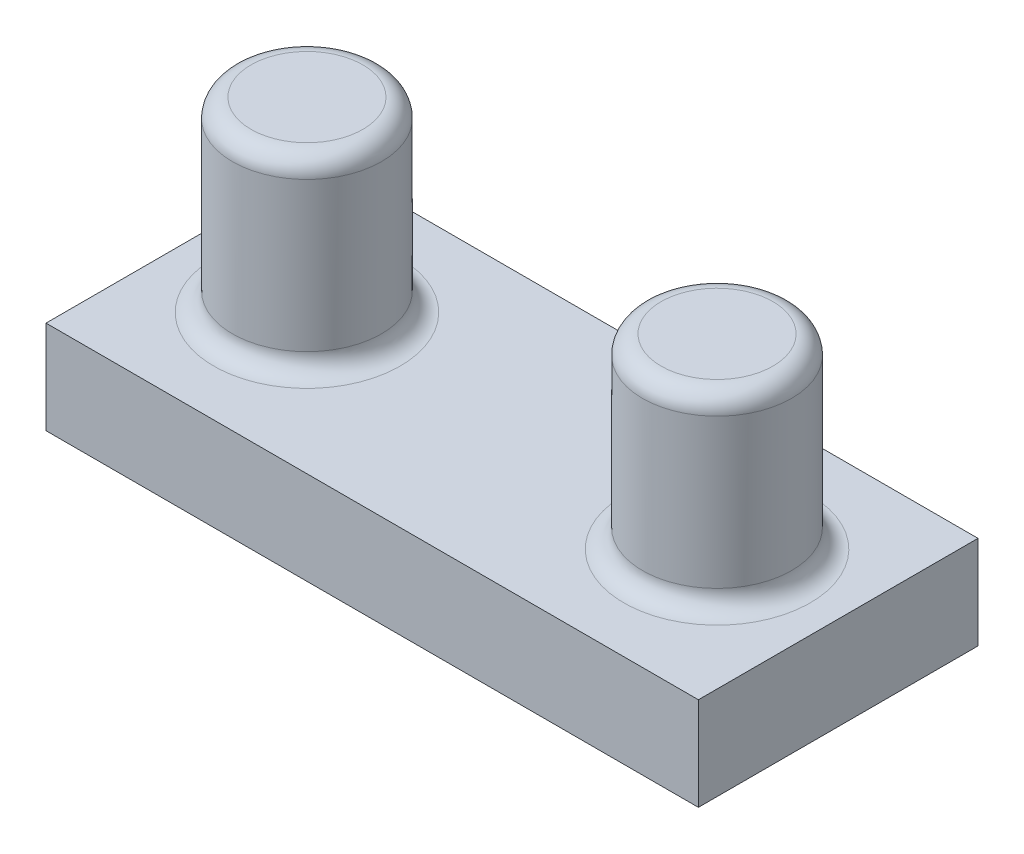
from build123d import *

# Parameters (mm, degrees)
SKETCH1_R             = 4
BOSS_EXTRUDE1_DEPTH   = 10
BOSS_EXTRUDE1_2_DEPTH = 10
SKETCH2_W             = 35
SKETCH2_H             = 15
BOSS_EXTRUDE2_DEPTH   = 5
FILLET1_R             = 1
CUT_EXTRUDE1_DEPTH    = 1


with BuildPart() as part:
    # Sketch1 → Boss-Extrude1 (new body)
    with BuildSketch(Plane(origin=(0, 0, 0), x_dir=(1, 0, 0), z_dir=(0, 1, 0))):
        with Locations(Location((11.086709746, 7.169703638, 0), (0, 0, 270))):
            Circle(SKETCH1_R)
    extrude(amount=BOSS_EXTRUDE1_DEPTH)



with BuildPart() as body_2:
    # Sketch1 → Boss-Extrude1 2 (new body)
    with BuildSketch(Plane(origin=(0, 0, 0), x_dir=(1, 0, 0), z_dir=(0, 1, 0))):
        with Locations(Location((-10.913290254, 7.169703638, 0), (0, 0, 270))):
            Circle(SKETCH1_R)
    extrude(amount=BOSS_EXTRUDE1_2_DEPTH)


with BuildPart() as part_1:
    add(part.part)

    add(body_2.part)  # Boss-Extrude2 merges body 2
    # Sketch2 → Boss-Extrude2 (add)
    with BuildSketch(Plane(origin=(0, 0, 0), x_dir=(-1, 0, 0), z_dir=(0, -1, 0))):
        with Locations((-0.086709746, 7.169703638)):
            Rectangle(SKETCH2_W, SKETCH2_H)
    extrude(amount=BOSS_EXTRUDE2_DEPTH)

    # Fillet1
    fillet1_edges = [part_1.edges().sort_by_distance(p)[0] for p in [
        (-10.913290254, 0, -11.169703638),
        (-10.913290254, 10, -11.169703638),
        (11.086709746, 10, -11.169703638),
        (11.086709746, 0, -11.169703638),
    ]]
    fillet(fillet1_edges, radius=FILLET1_R)

    # Sketch3 → Cut-Extrude1 (cut)
    with BuildSketch(Plane(origin=(0, 0, -14.669703638), x_dir=(-1, 0, 0), z_dir=(0, 0, -1))):
        with BuildLine():
            Line((4.304418078, -1.853490886), (4.618520642, -1.853490886))
            Line((4.618520642, -1.853490886), (4.618520642, -2.298002104))
            add(Edge.make_bspline(
                [(4.618520642, -2.298002104), (4.646804592, -2.259114502), (4.700999351, -2.184602129), (4.789865004, -2.086411845), (4.878641116, -2.00308369), (4.942574498, -1.959340819), (4.97328827, -1.938326623)],
                knots=[0, 0, 0, 0, 1.134379233, 2.173579362, 3.122582517, 4, 4, 4, 4], degree=3))
            add(Edge.make_bspline(
                [(4.97328827, -1.938326623), (5.015152932, -1.918321258), (5.098150832, -1.878660045), (5.229570057, -1.838426486), (5.364044726, -1.813701385), (5.45485294, -1.810320011), (5.50053186, -1.808619091)],
                knots=[0, 0, 0, 0, 1.014936303, 2.012140481, 3.000054389, 4, 4, 4, 4], degree=3))
            add(Edge.make_bspline(
                [(5.50053186, -1.808619091), (5.531424856, -1.809664382), (5.592560435, -1.811732956), (5.683144526, -1.825192992), (5.771003137, -1.848459165), (5.855617167, -1.880866489), (5.935337846, -1.920113175), (6.008427044, -1.966162883), (6.074051252, -2.017859959), (6.132177303, -2.077538892), (6.184446329, -2.14687549), (6.232525175, -2.227739739), (6.276950388, -2.3219474), (6.301571696, -2.390313941), (6.314534264, -2.426307393)],
                knots=[0, 0, 0, 0, 1.009824226, 1.998387844, 2.986035974, 3.974953746, 4.955485308, 5.885931332, 6.793869504, 7.679848016, 8.601185859, 9.625726857, 10.749998409, 12, 12, 12, 12], degree=3))
            add(Edge.make_bspline(
                [(6.314534264, -2.426307393), (6.328245515, -2.401582973), (6.355227332, -2.352928788), (6.400532969, -2.284070526), (6.448000766, -2.219663734), (6.498035259, -2.15965731), (6.550459846, -2.10434758), (6.605521246, -2.053551678), (6.662906027, -2.007051464), (6.742698267, -1.952728305), (6.846510875, -1.895027123), (6.977398989, -1.844998679), (7.113549161, -1.814082551), (7.205966859, -1.810452278), (7.252635225, -1.808619091)],
                knots=[0, 0, 0, 0, 0.86119277, 1.694706429, 2.50939023, 3.298075842, 4.073795165, 4.829715201, 5.57930267, 6.321991688, 7.768977793, 9.186738141, 10.579381044, 12, 12, 12, 12], degree=3))
            add(Edge.make_bspline(
                [(7.252635225, -1.808619091), (7.295516688, -1.810236312), (7.379439874, -1.81340137), (7.50161714, -1.838254844), (7.615558945, -1.880932491), (7.721036021, -1.939166127), (7.816195835, -2.012345311), (7.898912144, -2.099414148), (7.968682507, -2.199756771), (8.014261147, -2.29414876), (8.045176411, -2.377484093), (8.064237646, -2.448490384), (8.081077341, -2.526641937), (8.095058586, -2.612032199), (8.105277138, -2.704962807), (8.112847854, -2.805281683), (8.117971927, -2.913066794), (8.118333999, -2.987432295), (8.118520642, -3.025766527)],
                knots=[0, 0, 0, 0, 1.209669288, 2.367440248, 3.500751976, 4.631527125, 5.755587489, 6.87532382, 8.007944318, 9.190864318, 9.82315674, 10.514484317, 11.263564316, 12.079023757, 12.955305781, 13.901327259, 14.918167583, 16, 16, 16, 16], degree=3))
            Line((8.118520642, -3.025766527), (8.118520642, -4.411183194))
            Line((8.118520642, -4.411183194), (7.804418078, -4.411183194))
            Line((7.804418078, -4.411183194), (7.804418078, -3.024364284))
            add(Edge.make_bspline(
                [(7.804418078, -3.024364284), (7.804340195, -2.99164371), (7.804190516, -2.928759743), (7.801496884, -2.838507292), (7.79642157, -2.756238934), (7.790486931, -2.682066846), (7.782243122, -2.615818058), (7.77159719, -2.557625639), (7.76031951, -2.507031828), (7.741583519, -2.45094578), (7.711635627, -2.38907557), (7.666018147, -2.322351994), (7.608548041, -2.264271194), (7.542187885, -2.213852877), (7.46663944, -2.172859236), (7.383374717, -2.143583226), (7.292910665, -2.125460348), (7.230287877, -2.123654332), (7.197947725, -2.122721655)],
                knots=[0, 0, 0, 0, 1.253487763, 2.409012846, 3.458416907, 4.410876679, 5.259312806, 6.014470957, 6.676830364, 7.243083969, 8.276244668, 9.299465089, 10.325150304, 11.392391894, 12.482080715, 13.603491619, 14.762376348, 16, 16, 16, 16], degree=3))
            add(Edge.make_bspline(
                [(7.197947725, -2.122721655), (7.158277771, -2.124137813), (7.07987486, -2.126936678), (6.965429373, -2.155510551), (6.855458357, -2.198590802), (6.753243224, -2.261023259), (6.659215433, -2.335831623), (6.578315856, -2.424781219), (6.51148367, -2.525411146), (6.466229694, -2.618557848), (6.437640393, -2.702227292), (6.418763477, -2.775324664), (6.404080085, -2.858406232), (6.390309556, -2.950913722), (6.381321828, -3.053483903), (6.373153456, -3.165642304), (6.369332593, -3.287726263), (6.368798134, -3.372352952), (6.368520642, -3.416291367)],
                knots=[0, 0, 0, 0, 1.090531906, 2.155305635, 3.229839962, 4.33261226, 5.44038871, 6.529323825, 7.629011124, 8.757537029, 9.370236727, 10.061839251, 10.834451254, 11.692844982, 12.636905849, 13.66920014, 14.789842145, 16, 16, 16, 16], degree=3))
            Line((6.368520642, -3.416291367), (6.368520642, -4.411183194))
            Line((6.368520642, -4.411183194), (6.054418078, -4.411183194))
            Line((6.054418078, -4.411183194), (6.054418078, -3.110602264))
            add(Edge.make_bspline(
                [(6.054418078, -3.110602264), (6.054338647, -3.073908946), (6.05418583, -3.003314688), (6.051509512, -2.902081013), (6.046422891, -2.809999933), (6.040542342, -2.727178469), (6.032082164, -2.65376714), (6.022472402, -2.589372382), (6.011123791, -2.534155631), (5.992333906, -2.473592247), (5.963619438, -2.406871324), (5.917431176, -2.335730302), (5.859823596, -2.273462205), (5.79225272, -2.220303456), (5.716247038, -2.176361975), (5.632263637, -2.144702223), (5.541058724, -2.126277934), (5.478181018, -2.123929437), (5.44584436, -2.122721655)],
                knots=[0, 0, 0, 0, 1.320475261, 2.540461679, 3.643808994, 4.639130445, 5.527981419, 6.302341397, 6.981980563, 7.553956391, 8.582137848, 9.585246428, 10.591171744, 11.620968678, 12.668337649, 13.738356861, 14.836885341, 16, 16, 16, 16], degree=3))
            add(Edge.make_bspline(
                [(5.44584436, -2.122721655), (5.407828148, -2.124252115), (5.332063189, -2.127302268), (5.220761219, -2.154756542), (5.113275536, -2.197760617), (5.011320837, -2.257420436), (4.917646689, -2.331319514), (4.835638421, -2.41823441), (4.766695896, -2.517083444), (4.720964081, -2.60924796), (4.691465607, -2.690821235), (4.671870272, -2.760172183), (4.655030646, -2.837172431), (4.642516625, -2.922059542), (4.630436209, -3.014280636), (4.6246059, -3.114295126), (4.618934338, -3.222017214), (4.618661923, -3.296389759), (4.618520642, -3.334961239)],
                knots=[0, 0, 0, 0, 1.098833095, 2.189935336, 3.297829714, 4.440610912, 5.596351641, 6.740013378, 7.886572111, 9.072425424, 9.705826452, 10.395263256, 11.156850408, 11.985370555, 12.878090359, 13.847760091, 14.883794034, 16, 16, 16, 16], degree=3))
            Line((4.618520642, -3.334961239), (4.618520642, -4.411183194))
            Line((4.618520642, -4.411183194), (4.304418078, -4.411183194))
            Line((4.304418078, -4.411183194), (4.304418078, -1.853490886))
        make_face()
        with BuildLine():
            Line((-0.227633204, -1.853490886), (0.08646936, -1.853490886))
            Line((0.08646936, -1.853490886), (0.08646936, -2.298002104))
            add(Edge.make_bspline(
                [(0.08646936, -2.298002104), (0.11475331, -2.259114502), (0.168948069, -2.184602129), (0.257813722, -2.086411845), (0.346589834, -2.00308369), (0.410523216, -1.959340819), (0.441236988, -1.938326623)],
                knots=[0, 0, 0, 0, 1.134379233, 2.173579362, 3.122582517, 4, 4, 4, 4], degree=3))
            add(Edge.make_bspline(
                [(0.441236988, -1.938326623), (0.48310165, -1.918321258), (0.56609955, -1.878660045), (0.697518775, -1.838426486), (0.831993444, -1.813701385), (0.922801658, -1.810320011), (0.968480578, -1.808619091)],
                knots=[0, 0, 0, 0, 1.014936303, 2.012140481, 3.000054389, 4, 4, 4, 4], degree=3))
            add(Edge.make_bspline(
                [(0.968480578, -1.808619091), (0.999373574, -1.809664382), (1.060509153, -1.811732956), (1.151093243, -1.825192992), (1.238951855, -1.848459165), (1.323565885, -1.880866489), (1.403286564, -1.920113175), (1.476375762, -1.966162883), (1.54199997, -2.017859959), (1.600126021, -2.077538892), (1.652395047, -2.14687549), (1.700473893, -2.227739739), (1.744899106, -2.3219474), (1.769520414, -2.390313941), (1.782482982, -2.426307393)],
                knots=[0, 0, 0, 0, 1.009824226, 1.998387844, 2.986035974, 3.974953746, 4.955485308, 5.885931332, 6.793869504, 7.679848016, 8.601185859, 9.625726857, 10.749998409, 12, 12, 12, 12], degree=3))
            add(Edge.make_bspline(
                [(1.782482982, -2.426307393), (1.796194233, -2.401582973), (1.82317605, -2.352928788), (1.868481687, -2.284070526), (1.915949484, -2.219663734), (1.965983977, -2.15965731), (2.018408564, -2.10434758), (2.073469964, -2.053551678), (2.130854745, -2.007051464), (2.210646985, -1.952728305), (2.314459593, -1.895027123), (2.445347707, -1.844998679), (2.581497879, -1.814082551), (2.673915577, -1.810452278), (2.720583943, -1.808619091)],
                knots=[0, 0, 0, 0, 0.86119277, 1.694706429, 2.50939023, 3.298075842, 4.073795165, 4.829715201, 5.57930267, 6.321991688, 7.768977793, 9.186738141, 10.579381044, 12, 12, 12, 12], degree=3))
            add(Edge.make_bspline(
                [(2.720583943, -1.808619091), (2.763465406, -1.810236312), (2.847388592, -1.81340137), (2.969565858, -1.838254844), (3.083507663, -1.880932491), (3.188984739, -1.939166127), (3.284144553, -2.012345311), (3.366860862, -2.099414148), (3.436631225, -2.199756771), (3.482209865, -2.29414876), (3.513125129, -2.377484093), (3.532186364, -2.448490384), (3.549026059, -2.526641937), (3.563007304, -2.612032199), (3.573225856, -2.704962807), (3.580796572, -2.805281683), (3.585920645, -2.913066794), (3.586282717, -2.987432295), (3.58646936, -3.025766527)],
                knots=[0, 0, 0, 0, 1.209669288, 2.367440248, 3.500751976, 4.631527125, 5.755587489, 6.87532382, 8.007944318, 9.190864318, 9.82315674, 10.514484317, 11.263564316, 12.079023757, 12.955305781, 13.901327259, 14.918167583, 16, 16, 16, 16], degree=3))
            Line((3.58646936, -3.025766527), (3.58646936, -4.411183194))
            Line((3.58646936, -4.411183194), (3.272366796, -4.411183194))
            Line((3.272366796, -4.411183194), (3.272366796, -3.024364284))
            add(Edge.make_bspline(
                [(3.272366796, -3.024364284), (3.272288913, -2.99164371), (3.272139234, -2.928759743), (3.269445602, -2.838507292), (3.264370288, -2.756238934), (3.258435649, -2.682066846), (3.25019184, -2.615818058), (3.239545908, -2.557625639), (3.228268228, -2.507031828), (3.209532237, -2.45094578), (3.179584345, -2.38907557), (3.133966865, -2.322351994), (3.076496759, -2.264271194), (3.010136603, -2.213852877), (2.934588158, -2.172859236), (2.851323435, -2.143583226), (2.760859383, -2.125460348), (2.698236595, -2.123654332), (2.665896443, -2.122721655)],
                knots=[0, 0, 0, 0, 1.253487763, 2.409012846, 3.458416907, 4.410876679, 5.259312806, 6.014470957, 6.676830364, 7.243083969, 8.276244668, 9.299465089, 10.325150304, 11.392391894, 12.482080715, 13.603491619, 14.762376348, 16, 16, 16, 16], degree=3))
            add(Edge.make_bspline(
                [(2.665896443, -2.122721655), (2.626226489, -2.124137813), (2.547823578, -2.126936678), (2.433378091, -2.155510551), (2.323407075, -2.198590802), (2.221191942, -2.261023259), (2.127164151, -2.335831623), (2.046264573, -2.424781219), (1.979432388, -2.525411146), (1.934178412, -2.618557848), (1.905589111, -2.702227292), (1.886712195, -2.775324664), (1.872028803, -2.858406232), (1.858258274, -2.950913722), (1.849270546, -3.053483903), (1.841102174, -3.165642304), (1.837281311, -3.287726263), (1.836746852, -3.372352952), (1.83646936, -3.416291367)],
                knots=[0, 0, 0, 0, 1.090531906, 2.155305635, 3.229839962, 4.33261226, 5.44038871, 6.529323825, 7.629011124, 8.757537029, 9.370236727, 10.061839251, 10.834451254, 11.692844982, 12.636905849, 13.66920014, 14.789842145, 16, 16, 16, 16], degree=3))
            Line((1.83646936, -3.416291367), (1.83646936, -4.411183194))
            Line((1.83646936, -4.411183194), (1.522366796, -4.411183194))
            Line((1.522366796, -4.411183194), (1.522366796, -3.110602264))
            add(Edge.make_bspline(
                [(1.522366796, -3.110602264), (1.522287365, -3.073908946), (1.522134548, -3.003314688), (1.51945823, -2.902081013), (1.514371609, -2.809999933), (1.50849106, -2.727178469), (1.500030882, -2.65376714), (1.49042112, -2.589372382), (1.479072509, -2.534155631), (1.460282624, -2.473592247), (1.431568156, -2.406871324), (1.385379894, -2.335730302), (1.327772314, -2.273462205), (1.260201438, -2.220303456), (1.184195756, -2.176361975), (1.100212355, -2.144702223), (1.009007442, -2.126277934), (0.946129736, -2.123929437), (0.913793078, -2.122721655)],
                knots=[0, 0, 0, 0, 1.320475261, 2.540461679, 3.643808994, 4.639130445, 5.527981419, 6.302341397, 6.981980563, 7.553956391, 8.582137848, 9.585246428, 10.591171744, 11.620968678, 12.668337649, 13.738356861, 14.836885341, 16, 16, 16, 16], degree=3))
            add(Edge.make_bspline(
                [(0.913793078, -2.122721655), (0.875776866, -2.124252115), (0.800011907, -2.127302268), (0.688709937, -2.154756542), (0.581224254, -2.197760617), (0.479269555, -2.257420436), (0.385595407, -2.331319514), (0.303587139, -2.41823441), (0.234644614, -2.517083444), (0.188912799, -2.60924796), (0.159414325, -2.690821235), (0.13981899, -2.760172183), (0.122979364, -2.837172431), (0.110465342, -2.922059542), (0.098384927, -3.014280636), (0.092554618, -3.114295126), (0.086883056, -3.222017214), (0.086610641, -3.296389759), (0.08646936, -3.334961239)],
                knots=[0, 0, 0, 0, 1.098833095, 2.189935336, 3.297829714, 4.440610912, 5.596351641, 6.740013378, 7.886572111, 9.072425424, 9.705826452, 10.395263256, 11.156850408, 11.985370555, 12.878090359, 13.847760091, 14.883794034, 16, 16, 16, 16], degree=3))
            Line((0.08646936, -3.334961239), (0.08646936, -4.411183194))
            Line((0.08646936, -4.411183194), (-0.227633204, -4.411183194))
            Line((-0.227633204, -4.411183194), (-0.227633204, -1.853490886))
        make_face()
        with BuildLine():
            Line((-4.041735768, -1.988106271), (-4.355838332, -1.988106271))
            add(Edge.make_bspline(
                [(-4.355838332, -1.988106271), (-4.353791179, -1.946435383), (-4.349770625, -1.864594868), (-4.330942336, -1.745270962), (-4.304001459, -1.631216163), (-4.265910005, -1.523346249), (-4.218603727, -1.420707442), (-4.1618737, -1.323707426), (-4.094679849, -1.232716238), (-4.018473115, -1.148577394), (-3.935704476, -1.071389824), (-3.846398537, -1.004734581), (-3.752553509, -0.94841691), (-3.65445411, -0.901335668), (-3.550993547, -0.865995822), (-3.443110689, -0.839774182), (-3.330331553, -0.823997836), (-3.253491531, -0.822302051), (-3.21441205, -0.821439604)],
                knots=[0, 0, 0, 0, 1.10065271, 2.161652631, 3.183658789, 4.190468796, 5.17591951, 6.163126047, 7.15150782, 8.156236427, 9.156009102, 10.134482811, 11.092018607, 12.041330605, 13.001268258, 13.972401359, 14.968799086, 16, 16, 16, 16], degree=3))
            add(Edge.make_bspline(
                [(-3.21441205, -0.821439604), (-3.176033976, -0.822338061), (-3.100622432, -0.824103495), (-2.990560417, -0.839264525), (-2.885783123, -0.863010116), (-2.786495356, -0.896325533), (-2.693489292, -0.94110996), (-2.606066247, -0.994907499), (-2.523185436, -1.05712733), (-2.448578653, -1.130381144), (-2.380070573, -1.208583528), (-2.320968318, -1.292071432), (-2.270355155, -1.378300717), (-2.228167475, -1.467928919), (-2.197111336, -1.561799947), (-2.173533128, -1.65854715), (-2.160205714, -1.759171961), (-2.158160291, -1.827278517), (-2.157120384, -1.861904348)],
                knots=[0, 0, 0, 0, 1.111607364, 2.184268762, 3.212621178, 4.221274766, 5.211760367, 6.196651075, 7.1921475, 8.207485113, 9.220403448, 10.201281604, 11.166441695, 12.114753415, 13.065576456, 14.026450734, 14.996634279, 16, 16, 16, 16], degree=3))
            add(Edge.make_bspline(
                [(-2.157120384, -1.861904348), (-2.158813647, -1.910652182), (-2.162170458, -2.007292396), (-2.190884835, -2.149307259), (-2.235731346, -2.286900678), (-2.289728702, -2.39763798), (-2.344201147, -2.486871474), (-2.393288654, -2.560340179), (-2.450753465, -2.639445647), (-2.517431963, -2.723922984), (-2.591944835, -2.814433889), (-2.674966999, -2.910923685), (-2.767090481, -3.012395455), (-2.831748981, -3.081701056), (-2.865253397, -3.117613482)],
                knots=[0, 0, 0, 0, 1.184426356, 2.348067706, 3.509069118, 4.696110526, 5.333549288, 6.050745305, 6.844228056, 7.710549037, 8.667450064, 9.695053472, 10.805634456, 12, 12, 12, 12], degree=3))
            Line((-2.865253397, -3.117613482), (-3.740954518, -4.052208835))
            Line((-3.740954518, -4.052208835), (-2.112248589, -4.052208835))
            Line((-2.112248589, -4.052208835), (-2.112248589, -4.411183194))
            Line((-2.112248589, -4.411183194), (-4.490453717, -4.411183194))
            Line((-4.490453717, -4.411183194), (-3.133081922, -2.962665566))
            add(Edge.make_bspline(
                [(-3.133081922, -2.962665566), (-3.100034035, -2.928167259), (-3.036555808, -2.861903073), (-2.946773231, -2.765160112), (-2.866134243, -2.675410572), (-2.79411685, -2.592824023), (-2.732283345, -2.516192455), (-2.677411113, -2.447997752), (-2.633445522, -2.385243302), (-2.585730126, -2.312502688), (-2.539516145, -2.22369037), (-2.499803789, -2.115156681), (-2.475588941, -2.003429429), (-2.472684105, -1.927927391), (-2.471222948, -1.88994922)],
                knots=[0, 0, 0, 0, 1.329631726, 2.553950428, 3.673215718, 4.687767853, 5.603093632, 6.413772471, 7.123043292, 7.734684054, 8.834405432, 9.900288307, 10.943827018, 12, 12, 12, 12], degree=3))
            add(Edge.make_bspline(
                [(-2.471222948, -1.88994922), (-2.47185869, -1.866067821), (-2.473111616, -1.819002171), (-2.484169314, -1.749996412), (-2.50087982, -1.683431598), (-2.524825078, -1.619102979), (-2.556431818, -1.557657327), (-2.594905198, -1.499019847), (-2.639295261, -1.442330881), (-2.690646531, -1.389177583), (-2.74705805, -1.340496378), (-2.8066523, -1.297372292), (-2.869702404, -1.261333182), (-2.935942526, -1.231789684), (-3.005187996, -1.208614303), (-3.077572741, -1.192555724), (-3.152896757, -1.18247324), (-3.204330253, -1.181109068), (-3.230537852, -1.180413963)],
                knots=[0, 0, 0, 0, 0.991446411, 1.95395049, 2.89581595, 3.838931463, 4.798493298, 5.75982156, 6.748411868, 7.785213223, 8.824556874, 9.840280684, 10.836137867, 11.835679398, 12.848801643, 13.863922112, 14.911575587, 16, 16, 16, 16], degree=3))
            add(Edge.make_bspline(
                [(-3.230537852, -1.180413963), (-3.257908684, -1.181128995), (-3.311660481, -1.182533201), (-3.390579514, -1.192355865), (-3.465865291, -1.209301705), (-3.537707194, -1.232478379), (-3.60622678, -1.261936928), (-3.671090824, -1.298628673), (-3.732153713, -1.342412166), (-3.789530237, -1.392052722), (-3.842394216, -1.447320324), (-3.888841091, -1.508930287), (-3.929425106, -1.575757702), (-3.964834339, -1.647622253), (-3.993590029, -1.725176033), (-4.01556318, -1.808143738), (-4.032950026, -1.896165119), (-4.038758547, -1.956950204), (-4.041735768, -1.988106271)],
                knots=[0, 0, 0, 0, 1.031018746, 2.02475058, 2.990194455, 3.934040569, 4.864654155, 5.795059489, 6.735614925, 7.690564532, 8.649604399, 9.611025574, 10.590972636, 11.591080095, 12.624614302, 13.701020113, 14.821632451, 16, 16, 16, 16], degree=3))
        make_face()
        with BuildLine():
            Line((-6.734043461, -1.988106271), (-7.048146025, -1.988106271))
            add(Edge.make_bspline(
                [(-7.048146025, -1.988106271), (-7.046098872, -1.946435383), (-7.042078318, -1.864594868), (-7.023250029, -1.745270962), (-6.996309151, -1.631216163), (-6.958217697, -1.523346249), (-6.91091142, -1.420707442), (-6.854181392, -1.323707426), (-6.786987542, -1.232716238), (-6.710780808, -1.148577394), (-6.628012169, -1.071389824), (-6.538706229, -1.004734581), (-6.444861202, -0.94841691), (-6.346761803, -0.901335668), (-6.243301239, -0.865995822), (-6.135418381, -0.839774182), (-6.022639245, -0.823997836), (-5.945799223, -0.822302051), (-5.906719743, -0.821439604)],
                knots=[0, 0, 0, 0, 1.10065271, 2.161652631, 3.183658789, 4.190468796, 5.17591951, 6.163126047, 7.15150782, 8.156236427, 9.156009102, 10.134482811, 11.092018607, 12.041330605, 13.001268258, 13.972401359, 14.968799086, 16, 16, 16, 16], degree=3))
            add(Edge.make_bspline(
                [(-5.906719743, -0.821439604), (-5.868341669, -0.822338061), (-5.792930124, -0.824103495), (-5.68286811, -0.839264525), (-5.578090815, -0.863010116), (-5.478803049, -0.896325533), (-5.385796984, -0.94110996), (-5.298373939, -0.994907499), (-5.215493129, -1.05712733), (-5.140886345, -1.130381144), (-5.072378266, -1.208583528), (-5.013276011, -1.292071432), (-4.962662847, -1.378300717), (-4.920475167, -1.467928919), (-4.889419028, -1.561799947), (-4.86584082, -1.65854715), (-4.852513407, -1.759171961), (-4.850467983, -1.827278517), (-4.849428076, -1.861904348)],
                knots=[0, 0, 0, 0, 1.111607364, 2.184268762, 3.212621178, 4.221274766, 5.211760367, 6.196651075, 7.1921475, 8.207485113, 9.220403448, 10.201281604, 11.166441695, 12.114753415, 13.065576456, 14.026450734, 14.996634279, 16, 16, 16, 16], degree=3))
            add(Edge.make_bspline(
                [(-4.849428076, -1.861904348), (-4.851121339, -1.910652182), (-4.85447815, -2.007292396), (-4.883192527, -2.149307259), (-4.928039038, -2.286900678), (-4.982036395, -2.39763798), (-5.036508839, -2.486871474), (-5.085596346, -2.560340179), (-5.143061157, -2.639445647), (-5.209739655, -2.723922984), (-5.284252528, -2.814433889), (-5.367274691, -2.910923685), (-5.459398173, -3.012395455), (-5.524056674, -3.081701056), (-5.557561089, -3.117613482)],
                knots=[0, 0, 0, 0, 1.184426356, 2.348067706, 3.509069118, 4.696110526, 5.333549288, 6.050745305, 6.844228056, 7.710549037, 8.667450064, 9.695053472, 10.805634456, 12, 12, 12, 12], degree=3))
            Line((-5.557561089, -3.117613482), (-6.433262211, -4.052208835))
            Line((-6.433262211, -4.052208835), (-4.804556281, -4.052208835))
            Line((-4.804556281, -4.052208835), (-4.804556281, -4.411183194))
            Line((-4.804556281, -4.411183194), (-7.182761409, -4.411183194))
            Line((-7.182761409, -4.411183194), (-5.825389615, -2.962665566))
            add(Edge.make_bspline(
                [(-5.825389615, -2.962665566), (-5.792341728, -2.928167259), (-5.728863501, -2.861903073), (-5.639080924, -2.765160112), (-5.558441935, -2.675410572), (-5.486424543, -2.592824023), (-5.424591037, -2.516192455), (-5.369718805, -2.447997752), (-5.325753214, -2.385243302), (-5.278037819, -2.312502688), (-5.231823837, -2.22369037), (-5.192111481, -2.115156681), (-5.167896633, -2.003429429), (-5.164991797, -1.927927391), (-5.16353064, -1.88994922)],
                knots=[0, 0, 0, 0, 1.329631726, 2.553950428, 3.673215718, 4.687767853, 5.603093632, 6.413772471, 7.123043292, 7.734684054, 8.834405432, 9.900288307, 10.943827018, 12, 12, 12, 12], degree=3))
            add(Edge.make_bspline(
                [(-5.16353064, -1.88994922), (-5.164166382, -1.866067821), (-5.165419308, -1.819002171), (-5.176477006, -1.749996412), (-5.193187512, -1.683431598), (-5.21713277, -1.619102979), (-5.24873951, -1.557657327), (-5.28721289, -1.499019847), (-5.331602954, -1.442330881), (-5.382954223, -1.389177583), (-5.439365743, -1.340496378), (-5.498959992, -1.297372292), (-5.562010097, -1.261333182), (-5.628250219, -1.231789684), (-5.697495688, -1.208614303), (-5.769880433, -1.192555724), (-5.84520445, -1.18247324), (-5.896637945, -1.181109068), (-5.922845544, -1.180413963)],
                knots=[0, 0, 0, 0, 0.991446411, 1.95395049, 2.89581595, 3.838931463, 4.798493298, 5.75982156, 6.748411868, 7.785213223, 8.824556874, 9.840280684, 10.836137867, 11.835679398, 12.848801643, 13.863922112, 14.911575587, 16, 16, 16, 16], degree=3))
            add(Edge.make_bspline(
                [(-5.922845544, -1.180413963), (-5.950216377, -1.181128995), (-6.003968173, -1.182533201), (-6.082887206, -1.192355865), (-6.158172983, -1.209301705), (-6.230014886, -1.232478379), (-6.298534472, -1.261936928), (-6.363398516, -1.298628673), (-6.424461406, -1.342412166), (-6.481837929, -1.392052722), (-6.534701908, -1.447320324), (-6.581148784, -1.508930287), (-6.621732798, -1.575757702), (-6.657142031, -1.647622253), (-6.685897722, -1.725176033), (-6.707870872, -1.808143738), (-6.725257719, -1.896165119), (-6.731066239, -1.956950204), (-6.734043461, -1.988106271)],
                knots=[0, 0, 0, 0, 1.031018746, 2.02475058, 2.990194455, 3.934040569, 4.864654155, 5.795059489, 6.735614925, 7.690564532, 8.649604399, 9.611025574, 10.590972636, 11.591080095, 12.624614302, 13.701020113, 14.821632451, 16, 16, 16, 16], degree=3))
        make_face()
    extrude(amount=-CUT_EXTRUDE1_DEPTH, mode=Mode.SUBTRACT)


solid = part_1.part
